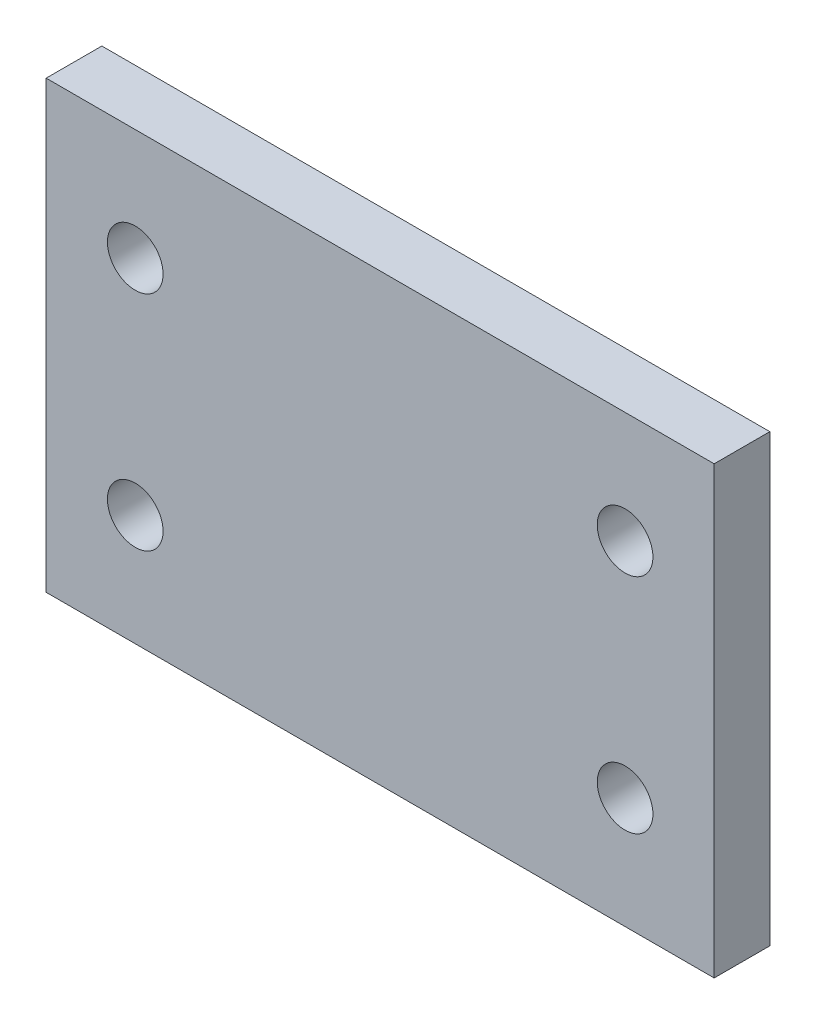
from build123d import *

# Parameters (mm, degrees)
SKETCH1_W           = 60
SKETCH1_H           = 40
BOSS_EXTRUDE1_DEPTH = 5
SKETCH2_R           = 2.5
CUT_EXTRUDE1_DEPTH  = 10


with BuildPart() as part:
    # Sketch1 → Boss-Extrude1 (new body)
    with BuildSketch(Plane.XY):
        with Locations((30, 20)):
            Rectangle(SKETCH1_W, SKETCH1_H)
    extrude(amount=BOSS_EXTRUDE1_DEPTH)

    # Sketch2 → Cut-Extrude1 (cut)
    with BuildSketch(Plane.XY.offset(5)):
        with Locations((8, 30)):
            Circle(SKETCH2_R)
        with Locations((8, 10)):
            Circle(SKETCH2_R)
        with Locations((52, 10)):
            Circle(SKETCH2_R)
        with Locations((52, 30)):
            Circle(SKETCH2_R)
    extrude(amount=-CUT_EXTRUDE1_DEPTH, mode=Mode.SUBTRACT)


solid = part.part
